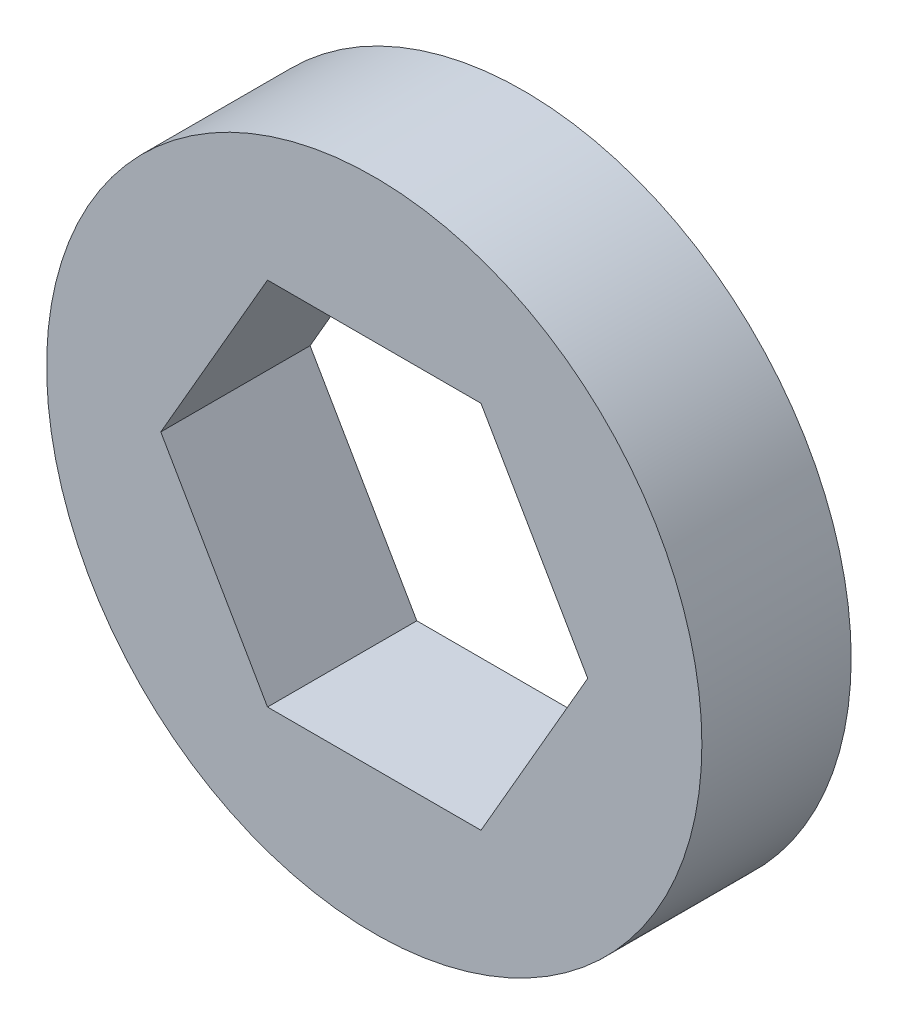
from build123d import *

# Parameters (mm, degrees)
SKETCH1_R           = 8.89
BOSS_EXTRUDE1_DEPTH = 2.02565


with BuildPart() as part:
    # Sketch1 → Boss-Extrude1 (new, symmetric)
    with BuildSketch(Plane.XY):
        Circle(SKETCH1_R)
        Polygon((-5.792555251, 0), (-2.896277625, -5.0165), (2.896277625, -5.0165), (5.792555251, 0), (2.896277625, 5.0165), (-2.896277625, 5.0165), align=None, mode=Mode.SUBTRACT)
    extrude(amount=BOSS_EXTRUDE1_DEPTH, both=True)


solid = part.part
